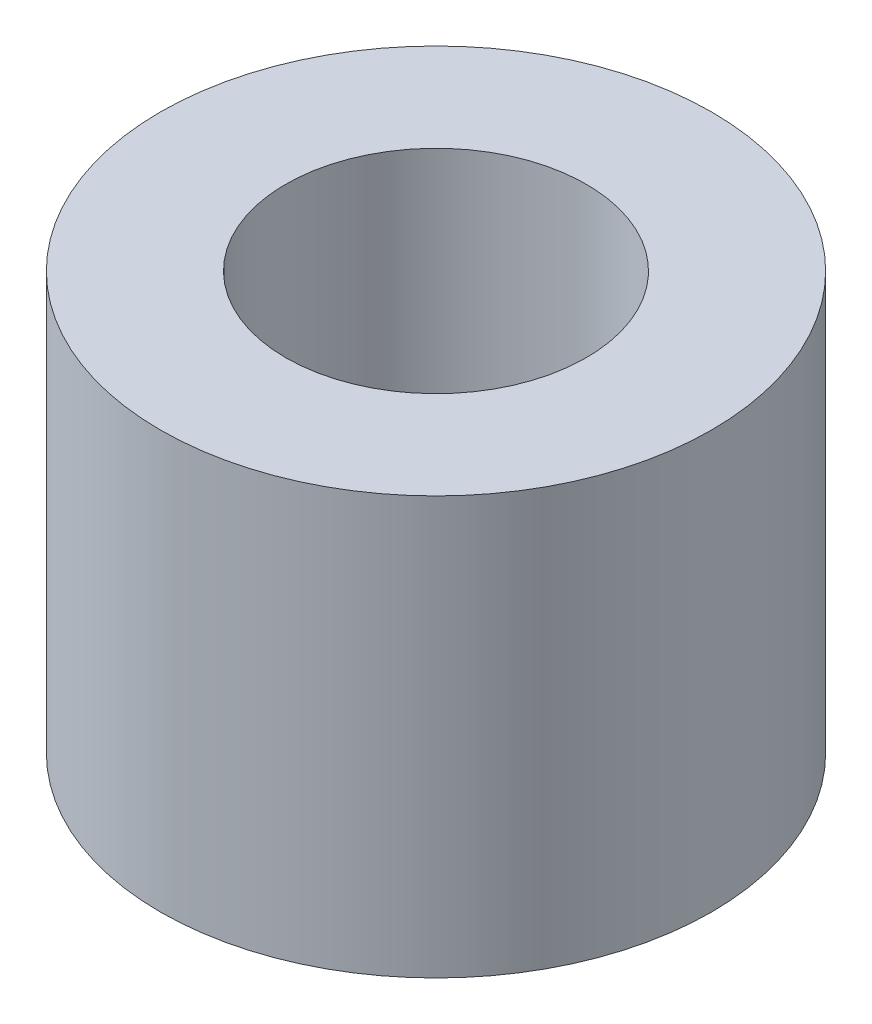
from build123d import *

# Parameters (mm, degrees)
SKETCH1_R           = 3.3
SKETCH1_R_2         = 1.8
BOSS_EXTRUDE1_DEPTH = 5


with BuildPart() as part:
    # Sketch1 → Boss-Extrude1 (new body)
    with BuildSketch(Plane(origin=(0, 0, 0), x_dir=(1, 0, 0), z_dir=(0, 1, 0))):
        with Locations(Location((0, 0, 0), (0, 0, 270))):
            Circle(SKETCH1_R)
        with Locations(Location((0, 0, 0), (0, 0, 270))):
            Circle(SKETCH1_R_2, mode=Mode.SUBTRACT)
    extrude(amount=BOSS_EXTRUDE1_DEPTH)


solid = part.part
